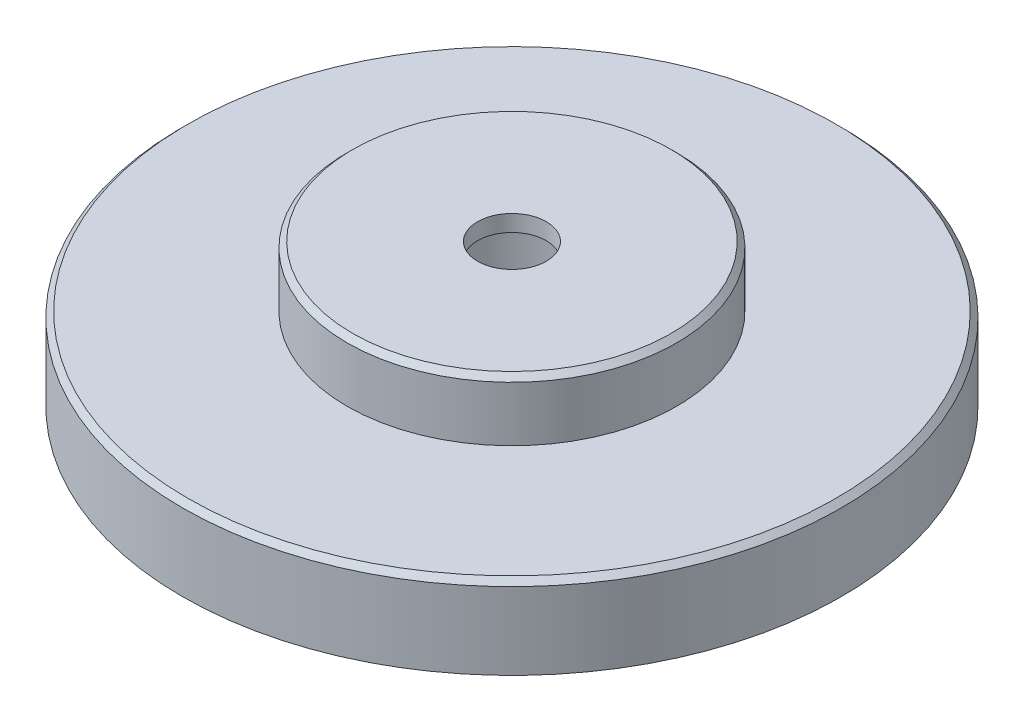
from build123d import *

# Parameters (mm, degrees)
SKETCH1_R           = 12
BOSS_EXTRUDE1_DEPTH = 2
SKETCH2_R           = 12
BOSS_EXTRUDE2_DEPTH = 1
SKETCH3_R           = 6
BOSS_EXTRUDE3_DEPTH = 2.2
SKETCH4_R           = 3
CUT_EXTRUDE1_DEPTH  = 2.6
CUT_EXTRUDE2_REACH  = 19.583
SKETCH5_R           = 1.25
CHAMFER1_SIZE       = 0.2


with BuildPart() as part:
    # Sketch1 → Boss-Extrude1 (new body)
    with BuildSketch(Plane(origin=(0, 0, 0), x_dir=(1, 0, 0), z_dir=(0, 1, 0))):
        with Locations(Location((0, 0, 0), (0, 0, 270))):
            Circle(SKETCH1_R)
        Polygon((-4.907477288, -8.5), (4.907477288, -8.5), (9.814954576, 0), (4.907477288, 8.5), (-4.907477288, 8.5), (-9.814954576, 0), align=None, mode=Mode.SUBTRACT)
    extrude(amount=BOSS_EXTRUDE1_DEPTH)

    # Sketch2 → Boss-Extrude2 (add)
    with BuildSketch(Plane(origin=(0, 2, 0), x_dir=(1, 0, 0), z_dir=(0, 1, 0))):
        with Locations(Location((0, 0, 0), (0, 0, 270))):
            Circle(SKETCH2_R)
    extrude(amount=BOSS_EXTRUDE2_DEPTH)

    # Sketch3 → Boss-Extrude3 (add)
    with BuildSketch(Plane(origin=(0, 3, 0), x_dir=(1, 0, 0), z_dir=(0, 1, 0))):
        with Locations(Location((0, 0, 0), (0, 0, 270))):
            Circle(SKETCH3_R)
    extrude(amount=BOSS_EXTRUDE3_DEPTH)

    # Sketch4 → Cut-Extrude1 (cut)
    with BuildSketch(Plane.XZ.offset(-2)):
        with Locations(Location((0, 0, 0), (0, 0, 270))):
            Circle(SKETCH4_R)
    extrude(amount=-CUT_EXTRUDE1_DEPTH, mode=Mode.SUBTRACT)

    # Sketch5 → Cut-Extrude2 (cut, up to next)
    with BuildSketch(Plane.XZ.offset(-4.6), mode=Mode.PRIVATE) as cut_extrude2_sk1:
        with Locations(Location((0, 0, 0), (0, 0, 270))):
            Circle(SKETCH5_R)
    cut_extrude2_tool1 = extrude(cut_extrude2_sk1.sketch, amount=-CUT_EXTRUDE2_REACH, mode=Mode.PRIVATE) & part.part
    add(cut_extrude2_tool1.solids().sort_by_distance((0, 4.6, 0))[0], mode=Mode.SUBTRACT)

    # Chamfer1
    chamfer1_edges = [part.edges().sort_by_distance(p)[0] for p in [
        (0, 3, -12),
        (0, 5.2, -6),
    ]]
    chamfer(chamfer1_edges, length=CHAMFER1_SIZE)


solid = part.part
